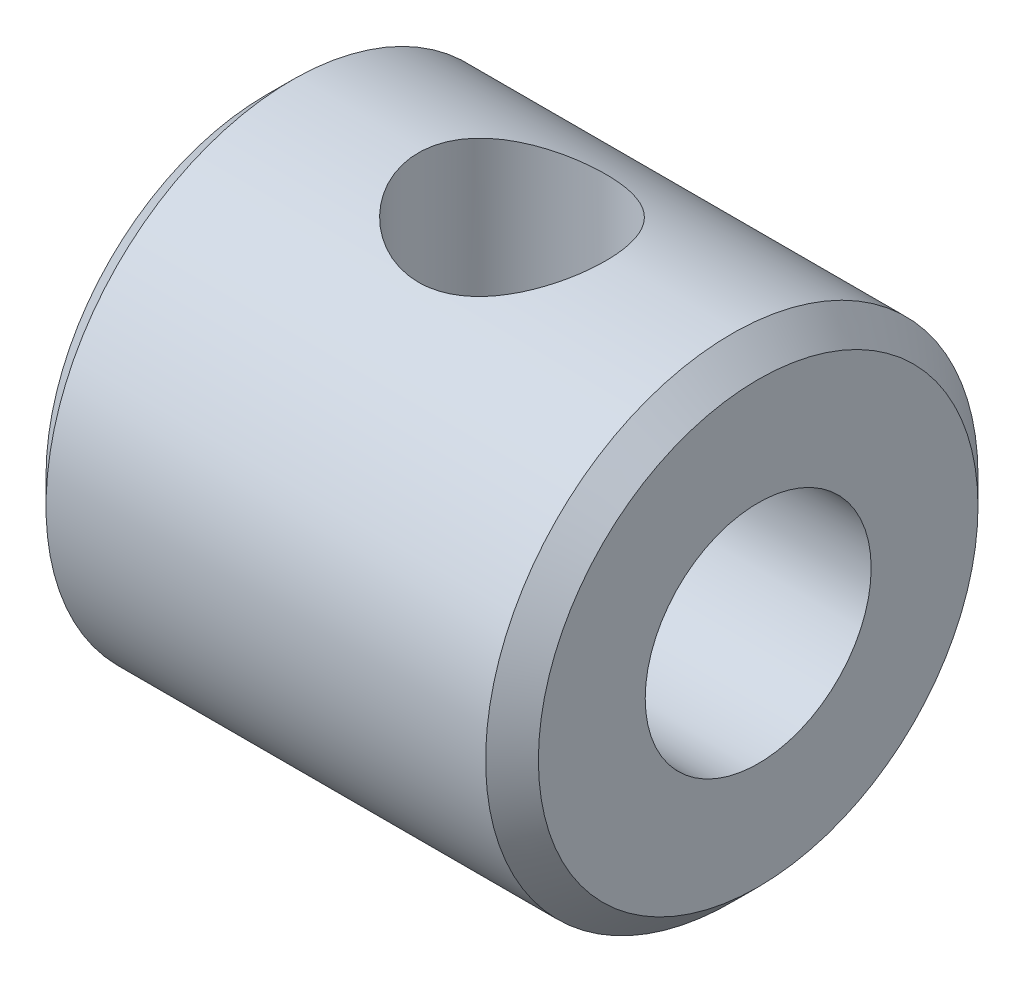
from build123d import *

# Parameters (mm, degrees)
SKETCH1_R                    = 3.556
BOSS_EXTRUDE1_DEPTH          = 3.556
F_30_0_1285_DIAMETER_HOLE1_D = 3.2639
CHAMFER2_SIZE                = 0.381
F_65_0_035_DIAMETER_HOLE2_D  = 0.889
F_6_32_TAPPED_HOLE1_D        = 2.7051
F_6_32_TAPPED_HOLE1_DEPTH    = 5.7912
F_6_32_TAPPED_HOLE1_TIP      = 0.81269403


with BuildPart() as part:
    # Sketch1 → Boss-Extrude1 (new, symmetric)
    with BuildSketch(Plane(origin=(0, 0, 0), x_dir=(0, 0, -1), z_dir=(1, 0, 0))):
        Circle(SKETCH1_R)
    extrude(amount=BOSS_EXTRUDE1_DEPTH, both=True)

    # #30 (0.1285) Diameter Hole1 (through all)
    with Locations(Plane(origin=(3.556, 0, 0), x_dir=(0, 0, -1), z_dir=(1, 0, 0))):
        with Locations((0, 0)):
            Hole(F_30_0_1285_DIAMETER_HOLE1_D / 2)

    # Chamfer2
    chamfer2_edges = [part.edges().sort_by_distance(p)[0] for p in [
        (-3.556, 0, 3.556),
        (3.556, 0, 3.556),
    ]]
    chamfer(chamfer2_edges, length=CHAMFER2_SIZE)

    # #65 (0.035) Diameter Hole2 (through all)
    with Locations(Plane(origin=(0, 3.556, 0), x_dir=(1, 0, 0), z_dir=(0, 1, 0))):
        with Locations((0, 0)):
            Hole(F_65_0_035_DIAMETER_HOLE2_D / 2)

    # #6-32 Tapped Hole1
    with Locations(Plane(origin=(0, 3.556, 0), x_dir=(1, 0, 0), z_dir=(0, 1, 0))):
        with Locations((0, 0)):
            Hole(F_6_32_TAPPED_HOLE1_D / 2, depth=F_6_32_TAPPED_HOLE1_DEPTH)
            with Locations((0, 0, -(F_6_32_TAPPED_HOLE1_DEPTH + F_6_32_TAPPED_HOLE1_TIP / 2))):  # 118° drill point
                Cone(0, F_6_32_TAPPED_HOLE1_D / 2, F_6_32_TAPPED_HOLE1_TIP, mode=Mode.SUBTRACT)


solid = part.part
